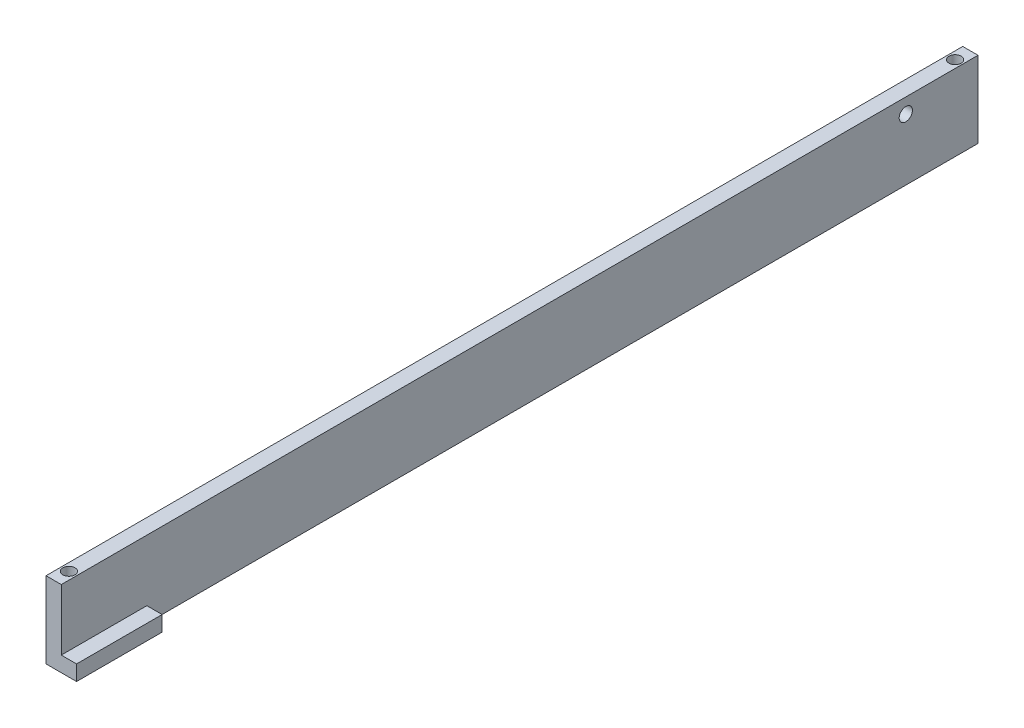
from build123d import *

# Parameters (mm, degrees)
BOSS_EXTRUDE1_DEPTH = 381
CUT_EXTRUDE1_REACH  = 384.532
SKETCH2_R           = 2.75
SKETCH3_R           = 2.54
CUT_EXTRUDE2_DEPTH  = 7.62
CUT_EXTRUDE3_START  = -7.62
SKETCH4_R           = 2.54
CUT_EXTRUDE3_DEPTH  = 7.62
SKETCH5_W           = 6.35
SKETCH5_H           = 6.35
CUT_EXTRUDE4_DEPTH  = 345.44


with BuildPart() as part:
    # Sketch1 → Boss-Extrude1 (new body)
    with BuildSketch(Plane.XY):
        Polygon((0, 0), (-12.7, 0), (-12.7, 31.75), (-6.35, 31.75), (-6.35, 6.35), (0, 6.35), align=None)
    extrude(amount=-BOSS_EXTRUDE1_DEPTH)

    # Sketch2 → Cut-Extrude1 (cut, up to next)
    with BuildSketch(Plane.ZY.offset(12.7), mode=Mode.PRIVATE) as cut_extrude1_sk1:
        with Locations(Location((-351, 25.5625, 0), (0, 0, 270))):
            Circle(SKETCH2_R)
    cut_extrude1_tool1 = extrude(cut_extrude1_sk1.sketch, amount=-CUT_EXTRUDE1_REACH, mode=Mode.PRIVATE) & part.part
    add(cut_extrude1_tool1.solids().sort_by_distance((-12.7, 25.5625, -351))[0], mode=Mode.SUBTRACT)

    # Sketch3 → Cut-Extrude2 (cut)
    with BuildSketch(Plane(origin=(0, 31.75, 0), x_dir=(1, 0, 0), z_dir=(0, 1, 0))):
        with Locations(Location((-9.525, 6.35, 0), (0, 0, 270))):
            Circle(SKETCH3_R)
        with Locations(Location((-9.525, 374.65, 0), (0, 0, 270))):
            Circle(SKETCH3_R)
    extrude(amount=-CUT_EXTRUDE2_DEPTH, mode=Mode.SUBTRACT)

    # Sketch4 → Cut-Extrude3 (cut)
    with BuildSketch(Plane.XZ.offset(CUT_EXTRUDE3_START)):
        with Locations(Location((-9.525, -374.65, 0), (0, 0, 90))):
            Circle(SKETCH4_R)
        with Locations(Location((-9.525, -6.35, 0), (0, 0, 90))):
            Circle(SKETCH4_R)
    extrude(amount=CUT_EXTRUDE3_DEPTH, mode=Mode.SUBTRACT)

    # Sketch5 → Cut-Extrude4 (cut)
    with BuildSketch(Plane(origin=(0, 0, -381), x_dir=(-1, 0, 0), z_dir=(0, 0, -1))):
        with Locations((3.175, 3.175)):
            Rectangle(SKETCH5_W, SKETCH5_H)
    extrude(amount=-CUT_EXTRUDE4_DEPTH, mode=Mode.SUBTRACT)


solid = part.part
